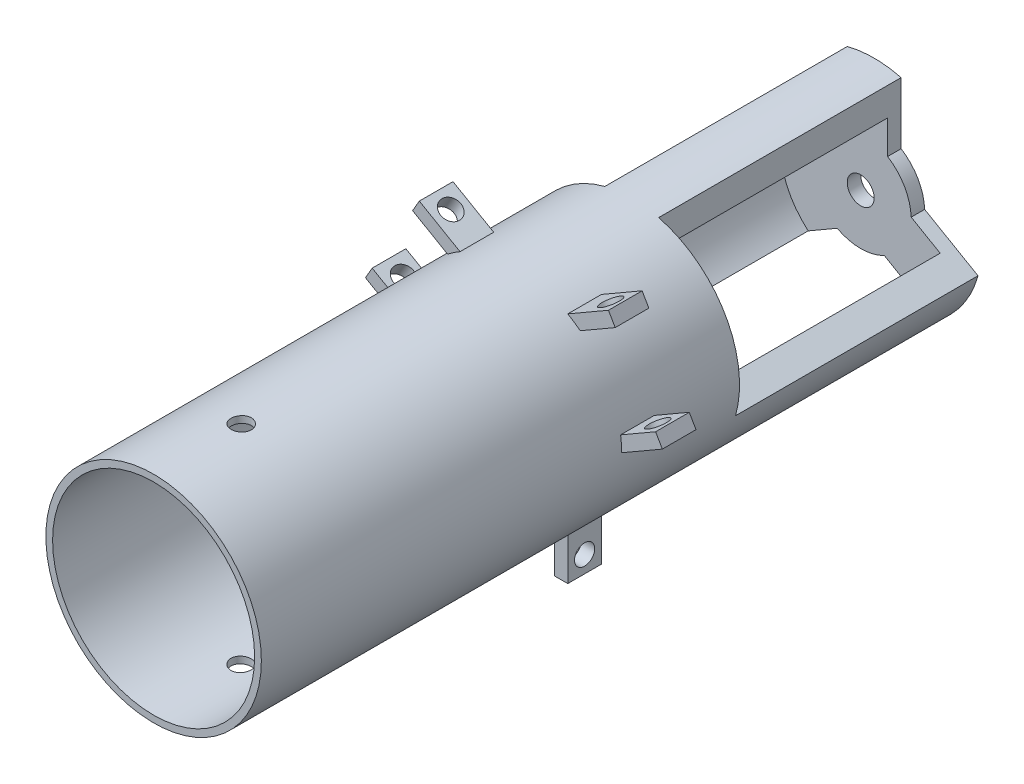
from build123d import *

# Parameters (mm, degrees)
SKETCH1_R           = 16
SKETCH1_R_2         = 15
BOSS_EXTRUDE1_DEPTH = 70
BOSS_EXTRUDE2_START = 1
SKETCH3_R           = 16
BOSS_EXTRUDE2_DEPTH = 1
CUT_EXTRUDE2_REACH  = 76.518
SKETCH4_R           = 6.5
BOSS_EXTRUDE3_START = 34
BOSS_EXTRUDE3_DEPTH = 34
BOSS_EXTRUDE4_START = 2
SKETCH6_R           = 2
BOSS_EXTRUDE4_DEPTH = 2
BOSS_EXTRUDE5_DEPTH = 2.5
SKETCH8_R           = 1.5
CUT_EXTRUDE3_DEPTH  = 77.740858419
CIRPATTERN1_COUNT   = 3
SKETCH9_R           = 1.5
CUT_EXTRUDE4_DEPTH  = 78.206291301
SKETCH10_W          = 1.5
SKETCH10_H          = 40


with BuildPart() as part:
    # Sketch1 → Boss-Extrude1 (new body)
    with BuildSketch(Plane.XY):
        Circle(SKETCH1_R)
        Circle(SKETCH1_R_2, mode=Mode.SUBTRACT)
    extrude(amount=BOSS_EXTRUDE1_DEPTH)

    # Sketch3 → Boss-Extrude2 (add)
    with BuildSketch(Plane(origin=(0, 0, 0), x_dir=(-1, 0, 0), z_dir=(0, 0, -1)).offset(BOSS_EXTRUDE2_START)):
        Circle(SKETCH3_R)
    extrude(amount=-BOSS_EXTRUDE2_DEPTH)

    # Sketch4 → Cut-Extrude2 (cut, up to next)
    with BuildSketch(Plane(origin=(0, 0, -1), x_dir=(-1, 0, 0), z_dir=(0, 0, -1)), mode=Mode.PRIVATE) as cut_extrude2_sk1:
        Circle(SKETCH4_R)
    cut_extrude2_tool1 = extrude(cut_extrude2_sk1.sketch, amount=-CUT_EXTRUDE2_REACH, mode=Mode.PRIVATE) & part.part
    add(cut_extrude2_tool1.solids().sort_by_distance((0, 0, -1))[0], mode=Mode.SUBTRACT)

    # Sketch5 → Boss-Extrude3 (add)
    with BuildSketch(Plane(origin=(0, 0, -1), x_dir=(-1, 0, 0), z_dir=(0, 0, -1)).offset(BOSS_EXTRUDE3_START)):
        with BuildLine():
            Line((-4, 15.491933385), (-4, 11.313708499))
            ThreePointArc((-4, 11.313708499), (0, 12), (4, 11.313708499))
            Line((4, 11.313708499), (4, 15.491933385))
            ThreePointArc((4, 15.491933385), (0, 16), (-4, 15.491933385))
        make_face()
        with BuildLine():
            Line((15.416407865, -4.281865077), (11.797958971, -2.192752634))
            ThreePointArc((11.797958971, -2.192752634), (10.392304845, -6), (7.797958971, -9.120955865))
            Line((7.797958971, -9.120955865), (11.416407865, -11.210068308))
            ThreePointArc((11.416407865, -11.210068308), (13.856406461, -8), (15.416407865, -4.281865077))
        make_face()
        with BuildLine():
            Line((-11.416407865, -11.210068308), (-7.797958971, -9.120955865))
            ThreePointArc((-7.797958971, -9.120955865), (-10.392304845, -6), (-11.797958971, -2.192752634))
            Line((-11.797958971, -2.192752634), (-15.416407865, -4.281865077))
            ThreePointArc((-15.416407865, -4.281865077), (-13.856406461, -8), (-11.416407865, -11.210068308))
        make_face()
    extrude(amount=-BOSS_EXTRUDE3_DEPTH)

    # Sketch6 → Boss-Extrude4 (add)
    with BuildSketch(Plane(origin=(0, 0, -35), x_dir=(-1, 0, 0), z_dir=(0, 0, -1)).offset(BOSS_EXTRUDE4_START)):
        with BuildLine():
            Line((-4, 15.491933385), (-4, 6.34428877))
            ThreePointArc((-4, 6.34428877), (-6.495190528, 3.75), (-7.494315244, 0.29195723))
            Line((-7.494315244, 0.29195723), (-15.416407865, -4.281865077))
            ThreePointArc((-15.416407865, -4.281865077), (-13.856406461, -8), (-11.416407865, -11.210068308))
            Line((-11.416407865, -11.210068308), (-3.494315244, -6.636246))
            ThreePointArc((-3.494315244, -6.636246), (0, -7.5), (3.494315244, -6.636246))
            Line((3.494315244, -6.636246), (11.416407865, -11.210068308))
            ThreePointArc((11.416407865, -11.210068308), (13.856406461, -8), (15.416407865, -4.281865077))
            Line((15.416407865, -4.281865077), (7.494315244, 0.29195723))
            ThreePointArc((7.494315244, 0.29195723), (6.495190528, 3.75), (4, 6.34428877))
            Line((4, 6.34428877), (4, 15.491933385))
            ThreePointArc((4, 15.491933385), (0, 16), (-4, 15.491933385))
        make_face()
        Circle(SKETCH6_R, mode=Mode.SUBTRACT)
    extrude(amount=-BOSS_EXTRUDE4_DEPTH)

    # Sketch7 → Boss-Extrude5 (add, symmetric)
    with BuildSketch(Plane(origin=(0, 0, 14), x_dir=(-1, 0, 0), z_dir=(0, 0, -1))):
        with BuildLine():
            Line((15.041385001, 15.61235091), (9.845232579, 12.61235091))
            ThreePointArc((9.845232579, 12.61235091), (8.94427191, 13.266499161), (8, 13.856406461))
            Line((8, 13.856406461), (14.041385001, 17.344401717))
            Line((14.041385001, 17.344401717), (15.041385001, 15.61235091))
        make_face()
        with BuildLine():
            Line((21.041385001, 5.220046064), (22.041385001, 3.487995257))
            Line((22.041385001, 3.487995257), (16, 0))
            ThreePointArc((16, 0), (15.961261248, 1.112717112), (15.845232579, 2.220046064))
            Line((15.845232579, 2.220046064), (21.041385001, 5.220046064))
        make_face()
    boss_extrude5 = extrude(amount=BOSS_EXTRUDE5_DEPTH, both=True)

    # Sketch8 → Cut-Extrude3 (cut, through all)
    with BuildSketch(Plane(origin=(-4, -6.92820323, 0), x_dir=(0.8660254037844398, -0.49999999999999806, 0), z_dir=(-0.499999999999998, -0.8660254037844397, 0))):
        with Locations((-18.332396974, 14)):
            Circle(SKETCH8_R)
    cut_extrude3 = extrude(amount=-CUT_EXTRUDE3_DEPTH, mode=Mode.SUBTRACT)

    # CirPattern1: Boss-Extrude5, Cut-Extrude3 ×3 about axis
    cirpattern1_axis = Axis((0, 0, 0), (0, 0, 1))
    add([boss_extrude5.rotate(cirpattern1_axis, i * 360 / CIRPATTERN1_COUNT) for i in range(1, CIRPATTERN1_COUNT)])
    add([cut_extrude3.rotate(cirpattern1_axis, i * 360 / CIRPATTERN1_COUNT) for i in range(1, CIRPATTERN1_COUNT)], mode=Mode.SUBTRACT)

    # Sketch9 → Cut-Extrude4 (cut, through all)
    with BuildSketch(Plane(origin=(0, 0, -1), x_dir=(-1, 0, 0), z_dir=(0, 0, -1))):
        with Locations((-12.5, 0)):
            Circle(SKETCH9_R)
        with Locations((12.5, 0)):
            Circle(SKETCH9_R)
    extrude(amount=-CUT_EXTRUDE4_DEPTH, mode=Mode.SUBTRACT)

    # Sketch10 → Cut-Revolve1 (revolve, cut)
    with BuildSketch(Plane.XY.offset(57), mode=Mode.PRIVATE) as cut_revolve1_sk:
        with Locations((0.75, 0)):
            Rectangle(SKETCH10_W, SKETCH10_H)
    revolve(cut_revolve1_sk.sketch.rotate(Axis((0, 0, 57), (0, 1, 0)), 90), axis=Axis((0, 0, 57), (0, 1, 0)), mode=Mode.SUBTRACT)


solid = part.part
